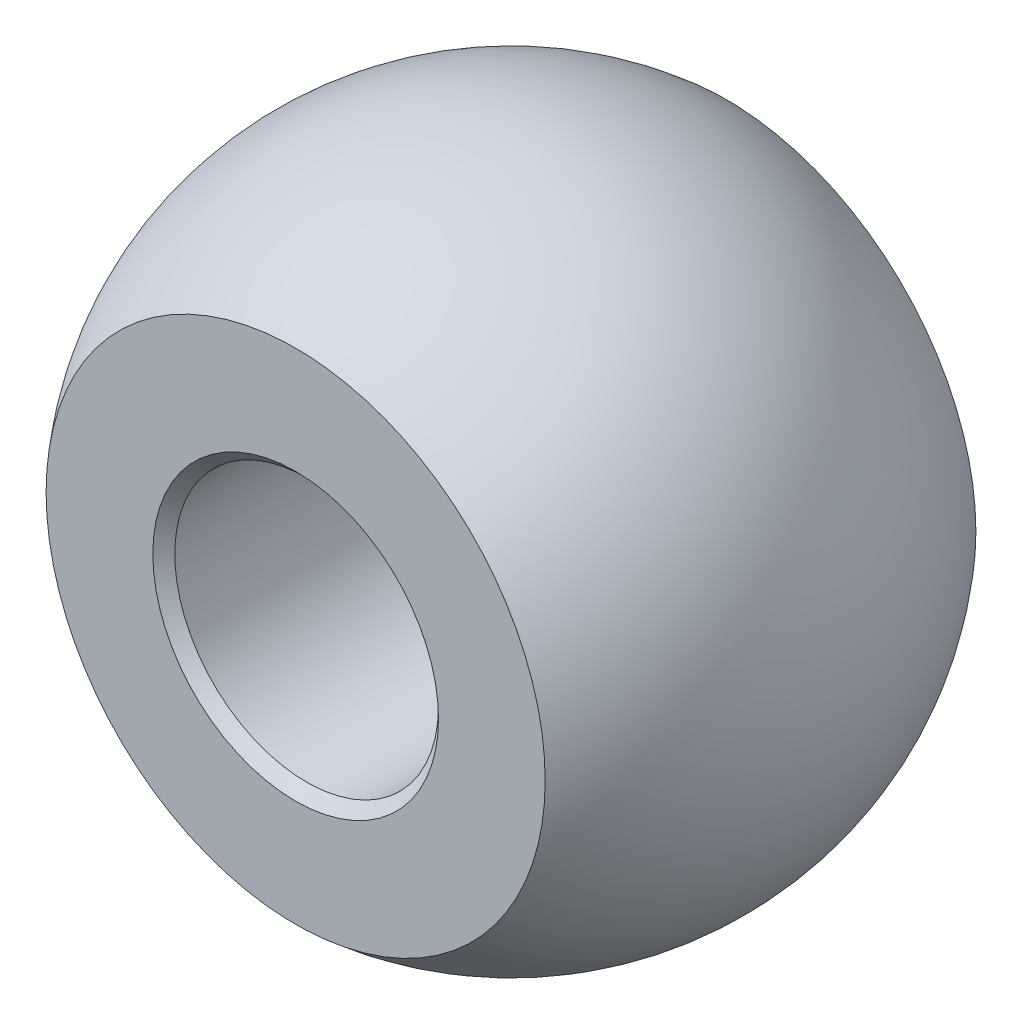
from build123d import *

# Parameters (mm, degrees)
CUT_EXTRUDE1_DEPTH      = 7.495190528
CUT_EXTRUDE1_DEPTH_BACK = 7.495190528
SKETCH2_W               = 2
SKETCH2_H               = 7.6
CUT_EXTRUDE2_DEPTH      = 9.158737647
CUT_EXTRUDE2_DEPTH_BACK = 9.158737647
SKETCH3_R               = 1.5
CHAMFER1_SIZE           = 0.125


with BuildPart() as part:
    # Sketch1 → Revolve1 (revolve)
    with BuildSketch(Plane.XY):
        with BuildLine():
            Line((0, 3.75), (0, -3.75))
            ThreePointArc((0, -3.75), (3.75, 0), (0, 3.75))
        make_face()
    revolve(axis=Axis((0, 3.75, 0), (0, -1, 0)))

    # Sketch2 → Cut-Extrude1 (cut, two sides: drawn at the far end of the back side and taken through both)
    with BuildSketch(Plane(origin=(0, 0, 0), x_dir=(0, 0, -1), z_dir=(1, 0, 0)).offset(-CUT_EXTRUDE1_DEPTH_BACK)):
        with Locations((-3.45, 0)):
            Rectangle(SKETCH2_W, SKETCH2_H)
        with Locations((3.45, 0)):
            Rectangle(SKETCH2_W, SKETCH2_H)
    extrude(amount=CUT_EXTRUDE1_DEPTH + CUT_EXTRUDE1_DEPTH_BACK, mode=Mode.SUBTRACT)

    # Sketch3 → Cut-Extrude2 (cut, two sides: drawn at the far end of the back side and taken through both)
    with BuildSketch(Plane.XY.offset(2.45).offset(-CUT_EXTRUDE2_DEPTH_BACK)):
        Circle(SKETCH3_R)
    extrude(amount=CUT_EXTRUDE2_DEPTH + CUT_EXTRUDE2_DEPTH_BACK, mode=Mode.SUBTRACT)

    # Chamfer1
    chamfer1_edges = [part.edges().sort_by_distance(p)[0] for p in [
        (-1.5, 0, -2.45),
        (-1.5, 0, 2.45),
    ]]
    chamfer(chamfer1_edges, length=CHAMFER1_SIZE)


solid = part.part
